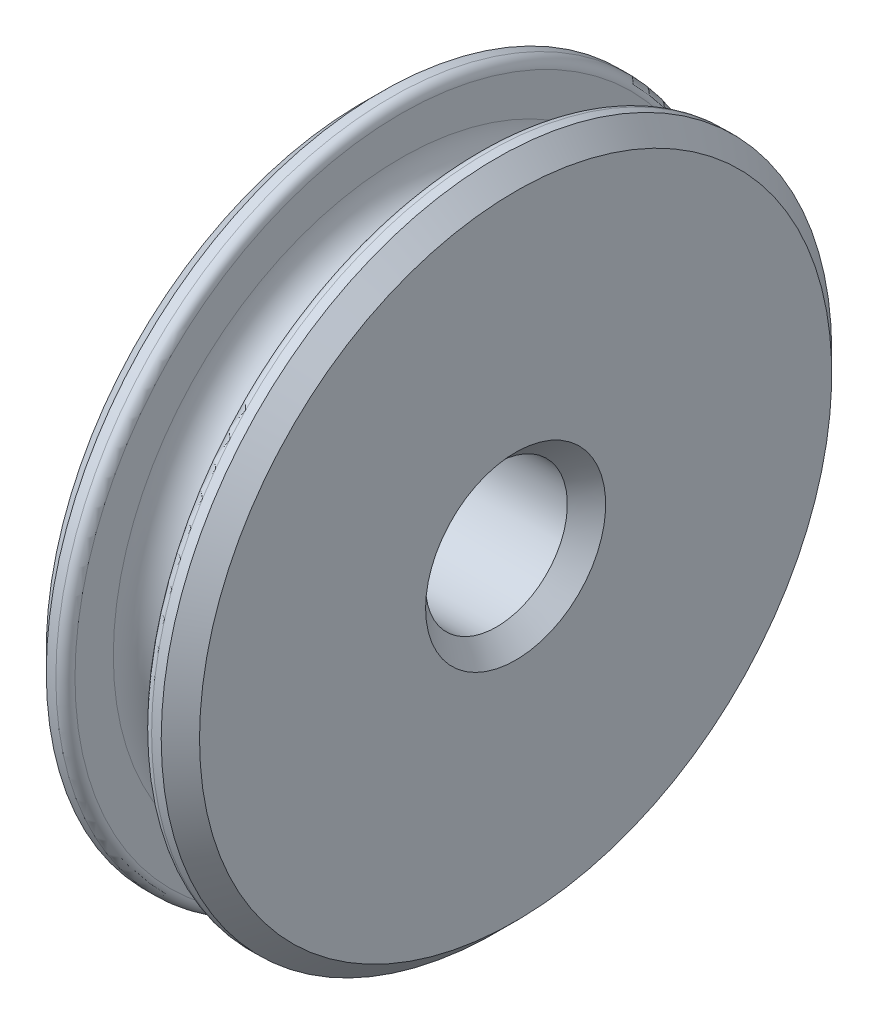
from build123d import *

# Parameters (mm, degrees)
FILLET1_R     = 0.25
CHAMFER1_SIZE = 0.5


with BuildPart() as part:
    # Sketch1 → Revolve1 (revolve)
    with BuildSketch(Plane.XY, mode=Mode.PRIVATE) as revolve1_sk:
        with BuildLine():
            Line((0, 8.75), (0, 1.85))
            Line((0, 1.85), (4, 1.85))
            Line((4, 1.85), (4, 8.75))
            Line((4, 8.75), (3, 8.75))
            Line((3, 8.75), (3, 7.5))
            ThreePointArc((3, 7.5), (2, 6.5), (1, 7.5))
            Line((1, 7.5), (1, 8.75))
            Line((1, 8.75), (0, 8.75))
        make_face()
    revolve(revolve1_sk.sketch.rotate(Axis((0, 0, 0), (1, 0, 0)), 90), axis=Axis((0, 0, 0), (1, 0, 0)))

    # Fillet1
    fillet1_edges = [part.edges().sort_by_distance(p)[0] for p in [
        (1, 0, -8.75),
        (3, 0, -8.75),
    ]]
    fillet(fillet1_edges, radius=FILLET1_R)

    # Chamfer1
    chamfer1_edges = [part.edges().sort_by_distance(p)[0] for p in [
        (0, 0, -8.75),
        (4, 0, -8.75),
        (4, 0, -1.85),
        (0, 0, -1.85),
    ]]
    chamfer(chamfer1_edges, length=CHAMFER1_SIZE)


solid = part.part
